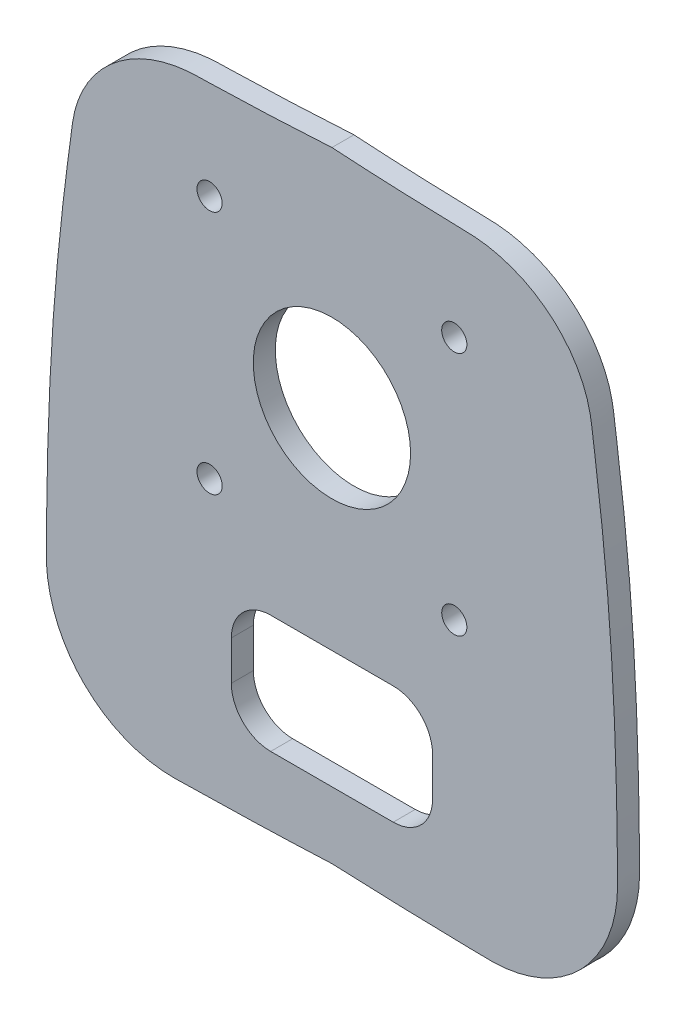
from build123d import *

# Parameters (mm, degrees)
SKETCH_1_R      = 1.6
SKETCH_1_R_2    = 10
EXTRUDE_1_DEPTH = 1.4


with BuildPart() as part:
    # Эскиз1 → Бобышка-Вытянуть1 (new, symmetric)
    with BuildSketch(Plane.XY):
        with BuildLine():
            add(Edge.make_bspline(
                [(-1.7704e-05, 132.322927634), (-1.371760751, 132.239321513), (-4.115875402, 132.078848464), (-8.23362328, 131.888165415), (-11.665971505, 131.758996413), (-14.414563819, 131.679991988), (-16.126060302, 131.631310781), (-17.511479305, 131.613771322), (-18.964095222, 131.513752966), (-21.451577661, 131.108256855), (-24.880325382, 129.873214023), (-28.494127818, 127.363991242), (-30.829272052, 124.518578915), (-32.136364771, 121.897378479), (-32.696226695, 120.162658079), (-32.966411068, 118.702984715), (-33.14223462, 117.341838908), (-33.380421376, 115.631916907), (-33.64667589, 113.580967167), (-33.990749122, 110.842843944), (-34.550086386, 106.045428384), (-35.215650903, 99.174439909), (-35.774491941, 90.909168494), (-36.061177897, 84.016068354), (-36.208112448, 78.501012377), (-36.268452632, 75.053936646), (-36.302212301, 72.297474853), (-36.312420398, 70.571424989), (-36.329207438, 69.199388946), (-36.282258703, 67.735758932), (-35.949444135, 65.237651481), (-34.79219419, 61.768706871), (-32.355246519, 58.120967586), (-29.018557138, 55.258602479), (-25.699099626, 53.719572441), (-22.868845204, 53.053905857), (-21.070989309, 52.871379808), (-19.621908648, 52.872036757), (-18.26031434, 52.900316329), (-15.836995212, 52.94725407), (-12.401557847, 53.030644355), (-6.886887794, 53.183810065), (-2.754621268, 53.342609034), (-0.000283533, 53.470169808)],
                knots=[-0.000368826, -0.000368826, -0.000368826, -0.000368826, 0.030883871, 0.062136569, 0.093389266, 0.109015615, 0.124641964, 0.132455138, 0.140268313, 0.155894661, 0.187147359, 0.218400056, 0.249652754, 0.265279102, 0.280905451, 0.288718626, 0.2965318, 0.312158149, 0.327784497, 0.343410846, 0.374663544, 0.437168939, 0.499674334, 0.562179729, 0.593432426, 0.624685124, 0.640311472, 0.655937821, 0.663750995, 0.67156417, 0.687190519, 0.718443216, 0.749695914, 0.780948611, 0.812201308, 0.827827657, 0.843454006, 0.85126718, 0.859080355, 0.874706703, 0.905959401, 0.937212098, 0.999717493, 0.999717493, 0.999717493, 0.999717493], degree=3))
            add(Edge.make_bspline(
                [(-0.000283533, 53.470169808), (2.754094638, 53.340654104), (6.888522349, 53.183893834), (12.398495023, 53.031220703), (15.845065175, 52.945251209), (18.591582756, 52.897105304), (20.692285008, 52.837766734), (22.873716389, 53.05303621), (25.694652964, 53.719782656), (29.016647568, 55.256106575), (32.36228509, 58.126497291), (34.801374071, 61.788402429), (35.954182028, 65.251709655), (36.282848898, 67.757903361), (36.330455103, 69.210327922), (36.310593777, 70.594166967), (36.302880948, 72.312138264), (36.267673514, 75.071275801), (36.207775726, 78.517081752), (36.060560432, 84.032256608), (35.773610412, 90.925490531), (35.214338901, 99.190516354), (34.548378832, 106.061434048), (33.988834203, 110.858715848), (33.644621823, 113.596773986), (33.378644687, 115.647528005), (33.139379753, 117.358397487), (32.965593659, 118.719380489), (32.691093333, 120.178069099), (32.130885586, 121.911840069), (30.819817687, 124.531737315), (28.486038903, 127.370991379), (24.879073128, 129.873567663), (21.45702751, 131.104440235), (18.597659532, 131.57875582), (16.453409051, 131.629242827), (14.418437139, 131.677774082), (11.663233833, 131.760322259), (8.23423005, 131.88775569), (4.115598031, 132.07891565), (1.371717297, 132.23938283), (-1.7704e-05, 132.322927634)],
                knots=[0.00028251, 0.00028251, 0.00028251, 0.00028251, 0.062787905, 0.094040603, 0.1252933, 0.140919649, 0.156545998, 0.172172347, 0.187798695, 0.219051393, 0.250304091, 0.281556788, 0.312809486, 0.328435835, 0.336249009, 0.344062184, 0.359688532, 0.375314881, 0.406567579, 0.437820276, 0.500325672, 0.562831067, 0.625336462, 0.65658916, 0.672215509, 0.687841857, 0.703468206, 0.711281381, 0.719094555, 0.734720904, 0.750347253, 0.78159995, 0.812852648, 0.844105346, 0.859731694, 0.875358043, 0.890984392, 0.906610741, 0.937863439, 0.969116136, 1.000368834, 1.000368834, 1.000368834, 1.000368834], degree=3))
        make_face()
        with Locations((15.556349186, 119.193294207)):
            Circle(SKETCH_1_R, mode=Mode.SUBTRACT)
        with Locations((0, 103.636945021)):
            Circle(SKETCH_1_R_2, mode=Mode.SUBTRACT)
        with Locations(Location((-15.556768202, 119.193608403, 0), (0, 0, 180))):
            Circle(SKETCH_1_R, mode=Mode.SUBTRACT)
        with Locations((-15.556768202, 88.080281639)):
            Circle(SKETCH_1_R, mode=Mode.SUBTRACT)
        with Locations(Location((15.556349186, 88.080595835, 0), (0, 0, 180))):
            Circle(SKETCH_1_R, mode=Mode.SUBTRACT)
        with BuildLine():
            Line((-7.791194804, 61.933969406), (7.791194804, 61.933969406))
            ThreePointArc((7.791194804, 61.933969406), (11.32672871, 63.3984355), (12.791194804, 66.933969406))
            Line((12.791194804, 66.933969406), (12.791194804, 71.933969406))
            ThreePointArc((12.791194804, 71.933969406), (11.32672871, 75.469503312), (7.791194804, 76.933969406))
            Line((7.791194804, 76.933969406), (-7.791194804, 76.933969406))
            ThreePointArc((-7.791194804, 76.933969406), (-11.32672871, 75.469503312), (-12.791194804, 71.933969406))
            Line((-12.791194804, 71.933969406), (-12.791194804, 66.933969406))
            ThreePointArc((-12.791194804, 66.933969406), (-11.32672871, 63.3984355), (-7.791194804, 61.933969406))
        make_face(mode=Mode.SUBTRACT)
    extrude(amount=EXTRUDE_1_DEPTH, both=True)


solid = part.part
